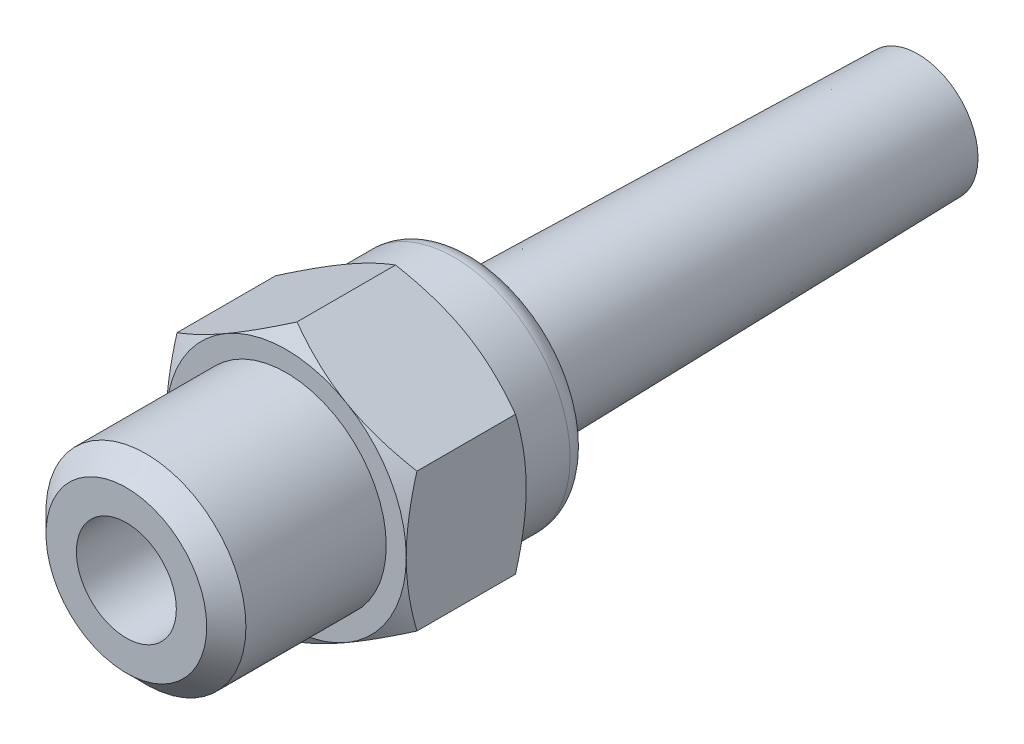
from build123d import *

# Parameters (mm, degrees)
SKIZZE2_W                       = 12
SKIZZE2_H                       = 12
SCHNITT_LINEAR_AUSTRAGEN1_DEPTH = 3


with BuildPart() as part:
    # Skizze1 → Rotation1 (revolve)
    with BuildSketch(Plane(origin=(0, 0, 0), x_dir=(0, 0, -1), z_dir=(1, 0, 0))):
        with BuildLine():
            Line((4, 0), (4, 1.25))
            Line((4, 1.25), (0, 1.25))
            Line((0, 1.25), (0, 2.0095))
            Line((0, 2.0095), (0.4905, 2.5))
            Line((0.4905, 2.5), (4, 2.5))
            Line((4, 2.5), (4, 3))
            Line((4, 3), (4.346410162, 3.6))
            Line((4.346410162, 3.6), (6.653589838, 3.6))
            Line((6.653589838, 3.6), (7, 3))
            Line((7, 3), (7, 2.9))
            Line((7, 2.9), (8.2, 2.9))
            ThreePointArc((8.2, 2.9), (8.553553391, 2.753553391), (8.7, 2.4))
            Line((8.7, 2.4), (8.7, 1.7415))
            Line((8.7, 1.7415), (19.8, 1.5))
            Line((19.8, 1.5), (19.8, 0))
            Line((19.8, 0), (4, 0))
        make_face()
    revolve(axis=Axis((0, 0, -19.8), (0, 0, 1)))

    # Skizze2 → Schnitt-Linear austragen1 (cut)
    with BuildSketch(Plane.XY.offset(-4)):
        Rectangle(SKIZZE2_W, SKIZZE2_H)
        Polygon((-3, -1.732050808), (0, -3.464101615), (3, -1.732050808), (3, 1.732050808), (0, 3.464101615), (-3, 1.732050808), align=None, mode=Mode.SUBTRACT)
    extrude(amount=-SCHNITT_LINEAR_AUSTRAGEN1_DEPTH, mode=Mode.SUBTRACT)


solid = part.part
